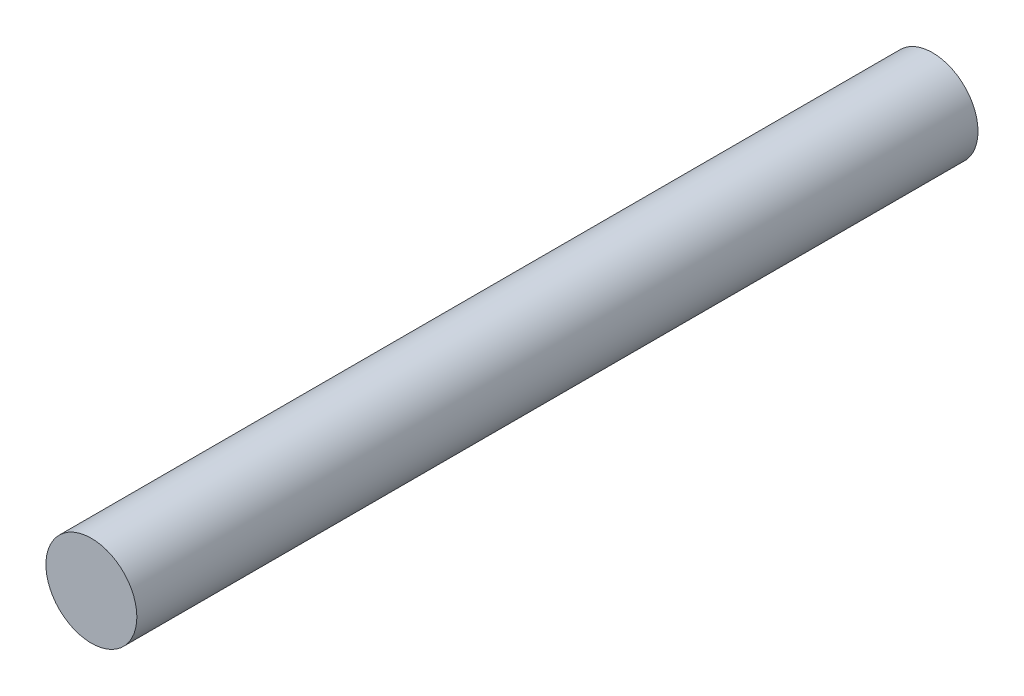
from build123d import *

# Parameters (mm, degrees)
SKETCH1_R           = 5
BOSS_EXTRUDE1_DEPTH = 92.5


with BuildPart() as part:
    # Sketch1 → Boss-Extrude1 (new body)
    with BuildSketch(Plane(origin=(0, 0, 0), x_dir=(0, 1, 0), z_dir=(0, 0, 1))):
        with Locations(Location((0, 0, 0), (0, 0, 270))):
            Circle(SKETCH1_R)
    extrude(amount=BOSS_EXTRUDE1_DEPTH)


solid = part.part
